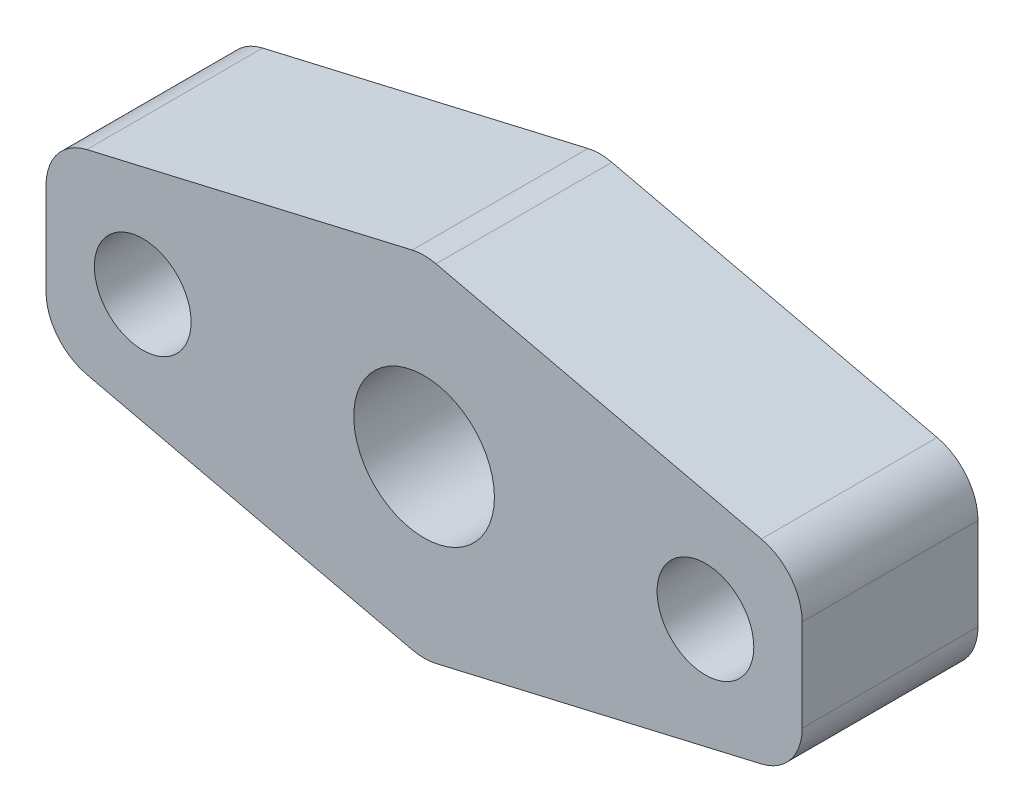
from build123d import *

# Parameters (mm, degrees)
SKETCH1_R           = 4
SKETCH1_R_2         = 2.75
BOSS_EXTRUDE1_DEPTH = 10
FILLET1_R           = 3


with BuildPart() as part:
    # Sketch1 → Boss-Extrude1 (new body)
    with BuildSketch(Plane.XY):
        Polygon((-21.5, -5), (-21.5, 5), (0, 10), (21.5, 5), (21.5, -5), (0, -10), align=None)
        Circle(SKETCH1_R, mode=Mode.SUBTRACT)
        with Locations((-16, 0)):
            Circle(SKETCH1_R_2, mode=Mode.SUBTRACT)
        with Locations((16, 0)):
            Circle(SKETCH1_R_2, mode=Mode.SUBTRACT)
    extrude(amount=BOSS_EXTRUDE1_DEPTH)

    # Fillet1
    fillet1_edges = [part.edges().sort_by_distance(p)[0] for p in [
        (21.5, 5, 5),
        (21.5, -5, 5),
        (0, -10, 5),
        (-21.5, -5, 5),
        (-21.5, 5, 5),
        (0, 10, 5),
    ]]
    fillet(fillet1_edges, radius=FILLET1_R)


solid = part.part
